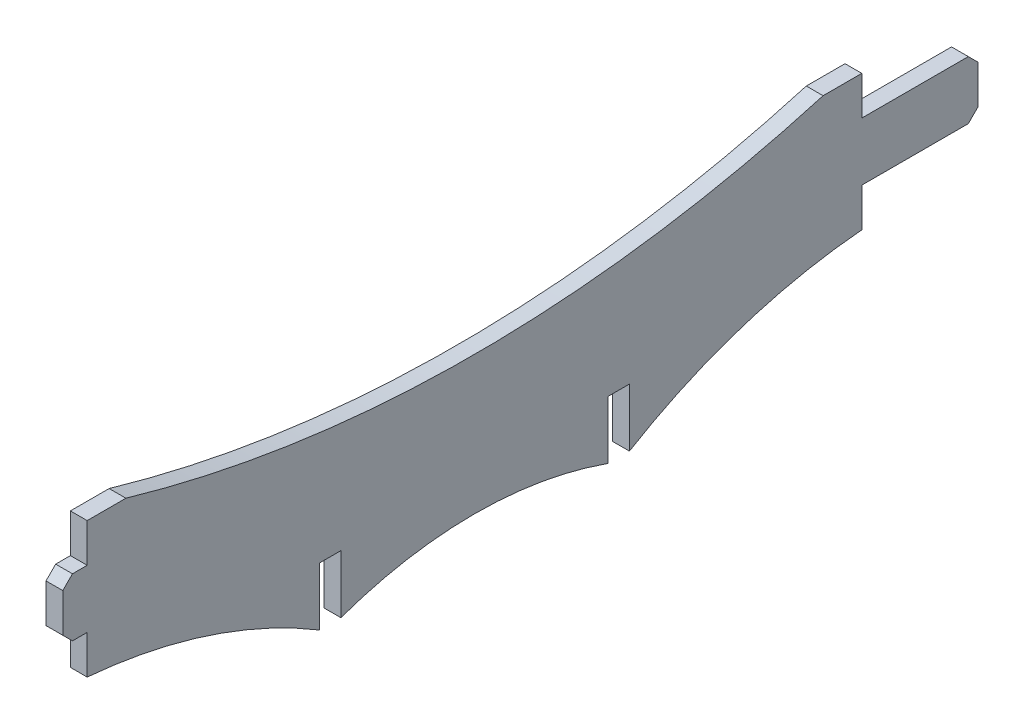
from build123d import *

# Parameters (mm, degrees)
BOSS_EXTRUDE1_DEPTH = 2.75
CHAMFER1_SIZE       = 1.5875


with BuildPart() as part:
    # Sketch1 → Boss-Extrude1 (new body)
    with BuildSketch(Plane.YZ):
        with BuildLine():
            Line((-9.525, 19.05), (-15.875, 19.05))
            ThreePointArc((-15.875, 19.05), (-19.876556287, 38.808169282), (-28.241659516, 57.15))
            Line((-28.241659516, 57.15), (-18.716659516, 57.15))
            Line((-18.716659516, 57.15), (-18.716659516, 60.65))
            Line((-18.716659516, 60.65), (-28.241659516, 60.65))
            ThreePointArc((-28.241659516, 60.65), (-24.444713557, 82.55), (-28.241659516, 104.45))
            Line((-28.241659516, 104.45), (-18.716659516, 104.45))
            Line((-18.716659516, 104.45), (-18.716659516, 107.95))
            Line((-18.716659516, 107.95), (-28.241659516, 107.95))
            ThreePointArc((-28.241659516, 107.95), (-19.876556287, 126.291830718), (-15.875, 146.05))
            Line((-15.875, 146.05), (-9.525, 146.05))
            Line((-9.525, 146.05), (-9.525, 150.05))
            Line((-9.525, 150.05), (0, 150.05))
            Line((0, 150.05), (0, 146.05))
            Line((0, 146.05), (6.35, 146.05))
            Line((6.35, 146.05), (6.35, 139.7))
            ThreePointArc((6.35, 139.7), (-1.810573999, 82.55), (6.35, 25.4))
            Line((6.35, 25.4), (6.35, 19.05))
            Line((6.35, 19.05), (0, 19.05))
            Line((0, 19.05), (0, 0))
            Line((0, 0), (-9.525, 0))
            Line((-9.525, 0), (-9.525, 19.05))
        make_face()
    extrude(amount=BOSS_EXTRUDE1_DEPTH)

    # Chamfer1
    chamfer1_edges = [part.edges().sort_by_distance(p)[0] for p in [
        (1.375, 0, 0),
        (1.375, -9.525, 0),
        (1.375, -9.525, 150.05),
        (1.375, 0, 150.05),
    ]]
    chamfer(chamfer1_edges, length=CHAMFER1_SIZE)


solid = part.part
